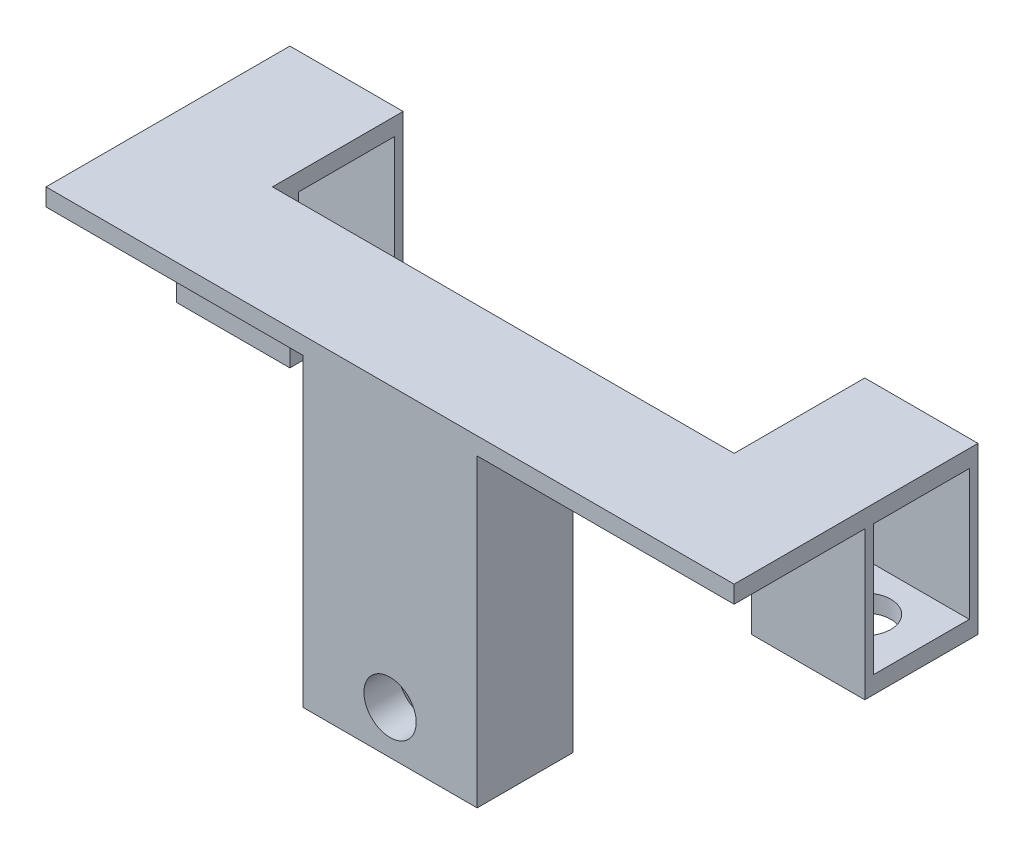
from build123d import *

# Parameters (mm, degrees)
SKETCH_2_W               = 13
SKETCH_2_H               = 13
SKETCH_2_R               = 3
EXTRUDE_1_DEPTH          = 2
EXTRUDE_1_2_DEPTH        = 2
SKETCH_3_W               = 13
SKETCH_3_H               = 1
EXTRUDE_2_DEPTH          = 15
SKETCH_4_W               = 13
SKETCH_4_H               = 12
SKETCH_4_H_2             = 1
SKETCH_4_W_2             = 53
SKETCH_4_H_3             = 13
EXTRUDE_3_DEPTH          = 2
SKETCH_5_W               = 20
SKETCH_5_H               = 11
EXTRUDE_4_DEPTH          = 37
CUT_EXTRUDE_1_DEPTH      = 84.246621553
CUT_EXTRUDE_1_DEPTH_BACK = 84.246621553
SKETCH_6_R               = 3
SKETCH_7_W               = 8
SKETCH_7_H               = 5
CUT_EXTRUDE_2_DEPTH      = 17
SKETCH_8_W               = 20
SKETCH_8_H               = 11
CUT_EXTRUDE_3_DEPTH      = 2


with BuildPart() as part:
    # ｽｹｯﾁ2 → ﾎﾞｽ - 押し出し1 (new body)
    with BuildSketch(Plane(origin=(0, 0, 0), x_dir=(1, 0, 0), z_dir=(0, 1, 0))):
        with Locations((6.5, 6.5)):
            Rectangle(SKETCH_2_W, SKETCH_2_H)
        with Locations(Location((6.5, 6.5, 0), (0, 0, 270))):
            Circle(SKETCH_2_R, mode=Mode.SUBTRACT)
    extrude(amount=EXTRUDE_1_DEPTH)



with BuildPart() as body_2:
    # ｽｹｯﾁ2 → Extrude 1 2 (new body)
    with BuildSketch(Plane(origin=(0, 0, 0), x_dir=(1, 0, 0), z_dir=(0, 1, 0))):
        with Locations((72.5, 6.5)):
            Rectangle(SKETCH_2_W, SKETCH_2_H)
        with Locations(Location((72.5, 6.5, 0), (0, 0, 90))):
            Circle(SKETCH_2_R, mode=Mode.SUBTRACT)
    extrude(amount=EXTRUDE_1_2_DEPTH)


with BuildPart() as part_1:
    add(part.part)

    add(body_2.part)  # ﾎﾞｽ - 押し出し2 merges body 2
    # ｽｹｯﾁ3 → ﾎﾞｽ - 押し出し2 (add)
    with BuildSketch(Plane(origin=(0, 2, 0), x_dir=(1, 0, 0), z_dir=(0, 1, 0))):
        with Locations((6.5, 12.5)):
            Rectangle(SKETCH_3_W, SKETCH_3_H)
        with Locations((6.5, 0.5)):
            Rectangle(SKETCH_3_W, SKETCH_3_H)
        with Locations((72.5, 0.5)):
            Rectangle(SKETCH_3_W, SKETCH_3_H)
        with Locations((72.5, 12.5)):
            Rectangle(SKETCH_3_W, SKETCH_3_H)
    extrude(amount=EXTRUDE_2_DEPTH)

    # ｽｹｯﾁ4 → ﾎﾞｽ - 押し出し3 (add)
    with BuildSketch(Plane(origin=(0, 17, 0), x_dir=(1, 0, 0), z_dir=(0, 1, 0))):
        Polygon((13, 0), (0, 0), (0, -15), (13, -15), (13, -2), align=None)
        with Locations((6.5, 7)):
            Rectangle(SKETCH_4_W, SKETCH_4_H)
        with Locations((6.5, 0.5)):
            Rectangle(SKETCH_4_W, SKETCH_4_H_2)
        with Locations((39.5, -8.5)):
            Rectangle(SKETCH_4_W_2, SKETCH_4_H_3)
        Polygon((66, -2), (66, -15), (79, -15), (79, 0), (79, 13), (66, 13), (66, 12), (66, 1), (66, 0), align=None)
    extrude(amount=EXTRUDE_3_DEPTH)

    # ｽｹｯﾁ5 → ﾎﾞｽ - 押し出し4 (add)
    with BuildSketch(Plane.XZ.offset(-17)):
        with Locations((39.5, 9.5)):
            Rectangle(SKETCH_5_W, SKETCH_5_H)
    extrude(amount=EXTRUDE_4_DEPTH)

    # ｽｹｯﾁ6 → ｶｯﾄ - 押し出し1 (cut, two sides: drawn at the far end of the back side and taken through both)
    with BuildSketch(Plane(origin=(0, 0, 4), x_dir=(-1, 0, 0), z_dir=(0, 0, -1)).offset(-CUT_EXTRUDE_1_DEPTH_BACK)):
        with Locations((-39.5, -13)):
            Circle(SKETCH_6_R)
    extrude(amount=CUT_EXTRUDE_1_DEPTH + CUT_EXTRUDE_1_DEPTH_BACK, mode=Mode.SUBTRACT)

    # ｽｹｯﾁ7 → ｶｯﾄ - 押し出し2 (cut)
    with BuildSketch(Plane.XZ.offset(20)):
        with Locations((39.5, 8.5)):
            Rectangle(SKETCH_7_W, SKETCH_7_H)
    extrude(amount=-CUT_EXTRUDE_2_DEPTH, mode=Mode.SUBTRACT)

    # ｽｹｯﾁ8 → ｶｯﾄ - 押し出し3 (cut)
    with BuildSketch(Plane.XZ.offset(20)):
        with Locations((39.5, 9.5)):
            Rectangle(SKETCH_8_W, SKETCH_8_H)
    extrude(amount=-CUT_EXTRUDE_3_DEPTH, mode=Mode.SUBTRACT)


solid = part_1.part
